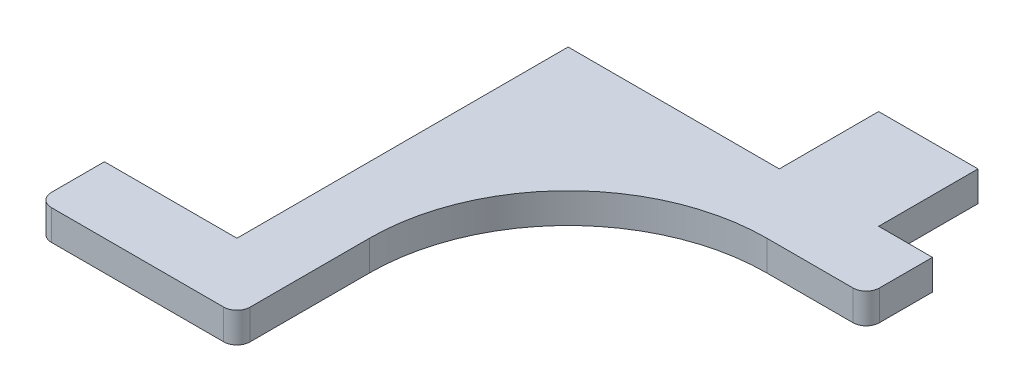
from build123d import *

# Parameters (mm, degrees)
BOSS_EXTRUDE1_DEPTH = 11.557
FILLET1_R           = 5.08


with BuildPart() as part:
    # Sketch1 → Boss-Extrude1 (new body)
    with BuildSketch(Plane(origin=(0, 0, 0), x_dir=(1, 0, 0), z_dir=(0, 1, 0))):
        with BuildLine():
            Line((50.8, 25.4), (50.8, 152.4))
            Line((50.8, 152.4), (131.7625, 152.4))
            Line((131.7625, 152.4), (131.7625, 190.5))
            Line((131.7625, 190.5), (169.8625, 190.5))
            Line((169.8625, 190.5), (169.8625, 152.4))
            Line((169.8625, 152.4), (190.5, 152.4))
            Line((190.5, 152.4), (190.5, 127))
            Line((190.5, 127), (152.4, 127))
            ThreePointArc((152.4, 127), (98.518463274, 104.681536726), (76.2, 50.8))
            Line((76.2, 50.8), (76.2, 0))
            Line((76.2, 0), (0, 0))
            Line((0, 0), (0, 25.4))
            Line((0, 25.4), (50.8, 25.4))
        make_face()
    extrude(amount=BOSS_EXTRUDE1_DEPTH)

    # Fillet1
    fillet1_edges = [part.edges().sort_by_distance(p)[0] for p in [
        (190.5, 5.7785, -127),
        (76.2, 5.7785, 0),
        (0, 5.7785, 0),
    ]]
    fillet(fillet1_edges, radius=FILLET1_R)


solid = part.part
